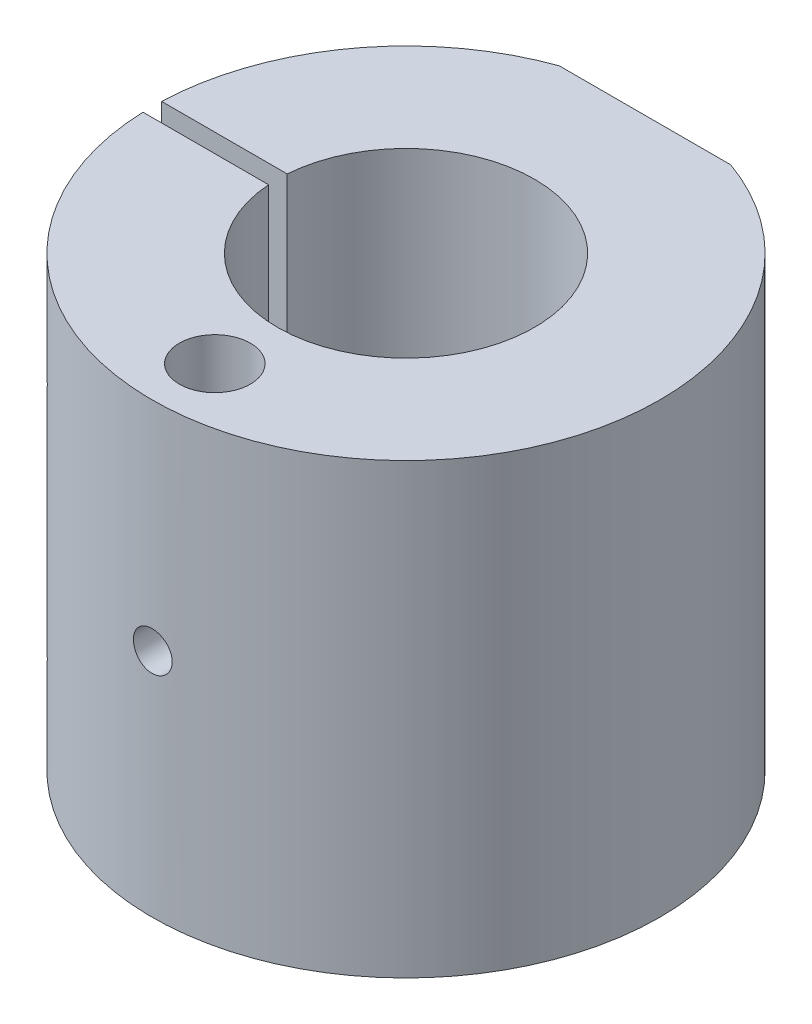
from build123d import *

# Parameters (mm, degrees)
SKETCH2_R                        = 21.59
SKETCH2_R_2                      = 10.922
BOSS_EXTRUDE1_DEPTH              = 38.1
CUT_EXTRUDE1_REACH               = 50.825
SKETCH3_W                        = 21.59
SKETCH3_H                        = 1.5875
CUT_EXTRUDE2_REACH               = 50.825
SKETCH4_R                        = 3.0226
CUT_EXTRUDE3_REACH               = 50.825
TAP_DRILL_FOR_M3X0_5_TAP1_D      = 2.5
TAP_DRILL_FOR_M3X0_5_TAP1_DEPTH  = 4.572
TAP_DRILL_FOR_M3X0_5_TAP1_TIP    = 0.751075774
CUT_EXTRUDE4_REACH               = 62.615
CUT_EXTRUDE4_END_RADIUS          = 3.0226
SKETCH8_R                        = 1.650000002
TAP_DRILL_FOR_M4X0_7_TAP1_REACH  = 54.19
TAP_DRILL_FOR_M4X0_7_TAP1_BORE_R = 1.65


with BuildPart() as part:
    # Sketch2 → Boss-Extrude1 (new body)
    with BuildSketch(Plane(origin=(0, 0, 0), x_dir=(1, 0, 0), z_dir=(0, 1, 0))):
        with Locations(Location((0, 0, 0), (0, 0, 90))):
            Circle(SKETCH2_R)
        with Locations(Location((0, 0, 0), (0, 0, 90))):
            Circle(SKETCH2_R_2, mode=Mode.SUBTRACT)
    extrude(amount=BOSS_EXTRUDE1_DEPTH)

    # Sketch3 → Cut-Extrude1 (cut, up to next)
    with BuildSketch(Plane(origin=(0, 38.1, 0), x_dir=(1, 0, 0), z_dir=(0, 1, 0)), mode=Mode.PRIVATE) as cut_extrude1_sk1:
        with Locations((-10.795, 0)):
            Rectangle(SKETCH3_W, SKETCH3_H)
    cut_extrude1_tool1 = extrude(cut_extrude1_sk1.sketch, amount=-CUT_EXTRUDE1_REACH, mode=Mode.PRIVATE) & part.part
    add(cut_extrude1_tool1.solids().sort_by_distance((-10.795, 38.1, 0))[0], mode=Mode.SUBTRACT)

    # Sketch4 → Cut-Extrude2 (cut, up to next)
    with BuildSketch(Plane(origin=(0, 38.1, 0), x_dir=(1, 0, 0), z_dir=(0, 1, 0)), mode=Mode.PRIVATE) as cut_extrude2_sk1:
        with Locations(Location((0, -16.256, 0), (0, 0, 270))):
            Circle(SKETCH4_R)
    cut_extrude2_tool1 = extrude(cut_extrude2_sk1.sketch, amount=-CUT_EXTRUDE2_REACH, mode=Mode.PRIVATE) & part.part
    add(cut_extrude2_tool1.solids().sort_by_distance((0, 38.1, 16.256))[0], mode=Mode.SUBTRACT)

    # Sketch5 → Cut-Extrude3 (cut, up to next)
    with BuildSketch(Plane(origin=(0, 38.1, 0), x_dir=(1, 0, 0), z_dir=(0, 1, 0)), mode=Mode.PRIVATE) as cut_extrude3_sk1:
        with BuildLine():
            Line((7.295594561, 20.32), (-7.295594561, 20.32))
            ThreePointArc((-7.295594561, 20.32), (0, 21.59), (7.295594561, 20.32))
        make_face()
    cut_extrude3_tool1 = extrude(cut_extrude3_sk1.sketch, amount=-CUT_EXTRUDE3_REACH, mode=Mode.PRIVATE) & part.part
    add(cut_extrude3_tool1.solids().sort_by_distance((0, 38.1, -20.829303))[0], mode=Mode.SUBTRACT)

    # Tap Drill for M3x0.5 Tap1
    with Locations(Plane(origin=(0, 19.05, -20.32), x_dir=(-1, 0, 0), z_dir=(0, 0, -1))):
        with Locations((0, 0)):
            Hole(TAP_DRILL_FOR_M3X0_5_TAP1_D / 2, depth=TAP_DRILL_FOR_M3X0_5_TAP1_DEPTH)
            with Locations((0, 0, -(TAP_DRILL_FOR_M3X0_5_TAP1_DEPTH + TAP_DRILL_FOR_M3X0_5_TAP1_TIP / 2))):  # 118° drill point
                Cone(0, TAP_DRILL_FOR_M3X0_5_TAP1_D / 2, TAP_DRILL_FOR_M3X0_5_TAP1_TIP, mode=Mode.SUBTRACT)

    # Cut-Extrude4: up to this cylinder (the profile starts outside it)
    cut_extrude4_end = Plane(origin=(0, 19.609114, 16.256), z_dir=(0, 1, 0)) * Cylinder(CUT_EXTRUDE4_END_RADIUS, 132.2752, mode=Mode.PRIVATE)
    # Sketch8 → Cut-Extrude4 (cut, up to the surface)
    with BuildSketch(Plane.XY.offset(21.59), mode=Mode.PRIVATE) as cut_extrude4_sk1:
        with Locations((0, 19.609113622)):
            Circle(SKETCH8_R)
    cut_extrude4_tool1 = extrude(cut_extrude4_sk1.sketch, amount=-CUT_EXTRUDE4_REACH, mode=Mode.PRIVATE) - cut_extrude4_end
    add(cut_extrude4_tool1.solids().sort_by_distance((0, 19.609114, 21.59))[0], mode=Mode.SUBTRACT)

    # Tap Drill for M4x0.7 Tap1 bore (on position points) → Tap Drill for M4x0.7 Tap1 (cut, up to next)
    with BuildSketch(Plane(origin=(-16.234261615, 29.109235595, 0.79375), x_dir=(-1, 0, 0), z_dir=(0, 0, -1)), mode=Mode.PRIVATE) as tap_drill_for_m4x0_7_tap1_sk1:
        Circle(TAP_DRILL_FOR_M4X0_7_TAP1_BORE_R)
    tap_drill_for_m4x0_7_tap1_tool1 = extrude(tap_drill_for_m4x0_7_tap1_sk1.sketch, amount=-TAP_DRILL_FOR_M4X0_7_TAP1_REACH, mode=Mode.PRIVATE) & part.part
    # Tap Drill for M4x0.7 Tap1 bore (on position points) → Tap Drill for M4x0.7 Tap1 (cut, up to next)
    with BuildSketch(Plane(origin=(-16.234261615, 29.109235595, 0.79375), x_dir=(-1, 0, 0), z_dir=(0, 0, -1)), mode=Mode.PRIVATE) as tap_drill_for_m4x0_7_tap1_sk2:
        with Locations((0, -20.205281104)):
            Circle(TAP_DRILL_FOR_M4X0_7_TAP1_BORE_R)
    tap_drill_for_m4x0_7_tap1_tool2 = extrude(tap_drill_for_m4x0_7_tap1_sk2.sketch, amount=-TAP_DRILL_FOR_M4X0_7_TAP1_REACH, mode=Mode.PRIVATE) & part.part
    add(tap_drill_for_m4x0_7_tap1_tool1.solids().sort_by_distance((-16.234262, 29.109236, 0.79375))[0], mode=Mode.SUBTRACT)
    add(tap_drill_for_m4x0_7_tap1_tool2.solids().sort_by_distance((-16.234262, 8.903954, 0.79375))[0], mode=Mode.SUBTRACT)


solid = part.part
